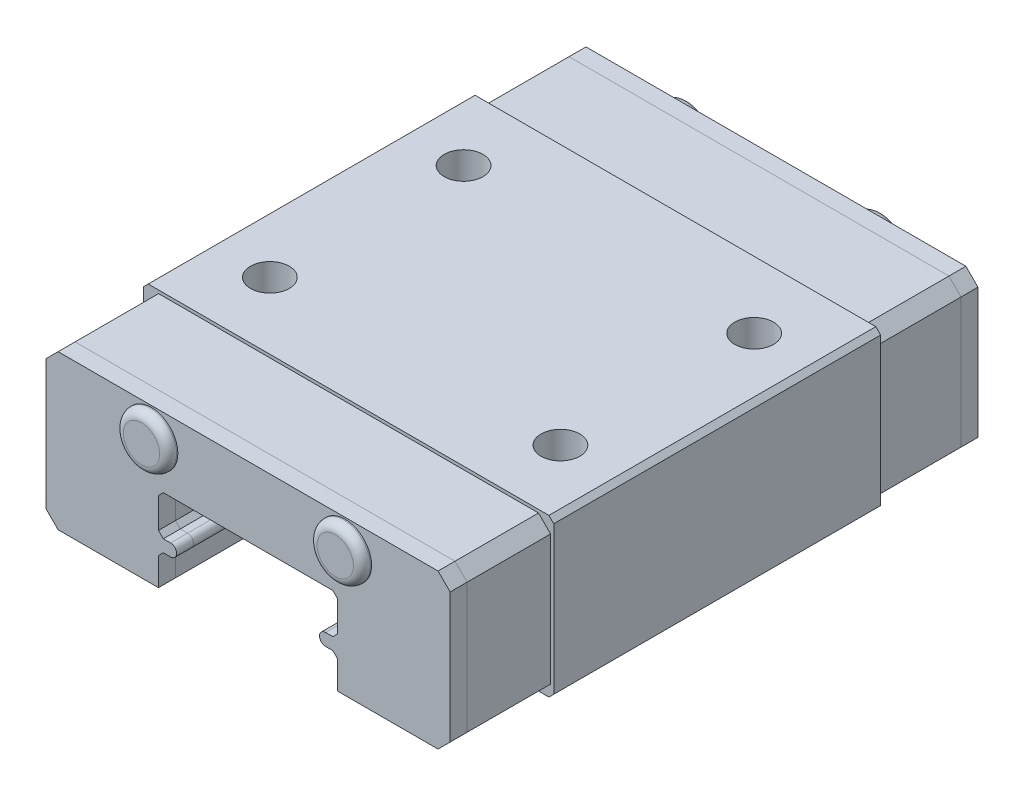
from build123d import *

# Parameters (mm, degrees)
SKETCH1_W                       = 16.95
SKETCH1_H                       = 6.5
BOSS_EXTRUDE1_DEPTH             = 6.75
CUT_EXTRUDE1_DEPTH              = 18.214111217
CUT_EXTRUDE1_DEPTH_BACK         = 18.214111217
CHAMFER1_SIZE                   = 0.2
TAP_DRILL_FOR_M2X0_4_TAP1_D     = 1.6
TAP_DRILL_FOR_M2X0_4_TAP1_DEPTH = 4.5
TAP_DRILL_FOR_M2X0_4_TAP1_TIP   = 0.480688495
BOSS_EXTRUDE2_DEPTH             = 3.45
CHAMFER2_SIZE                   = 0.5
BOSS_EXTRUDE3_DEPTH             = 0.7
SKETCH7_R                       = 1.1
BOSS_EXTRUDE4_DEPTH             = 0.4
BOSS_EXTRUDE4_2_DEPTH           = 0.4
FILLET1_R                       = 0.35
FILLET2_R                       = 0.35


with BuildPart() as part:
    # Sketch1 → Boss-Extrude1 (new, symmetric)
    with BuildSketch(Plane.XY):
        with Locations((0, 3.25)):
            Rectangle(SKETCH1_W, SKETCH1_H)
    extrude(amount=BOSS_EXTRUDE1_DEPTH, both=True)

    # Sketch2 → Cut-Extrude1 (cut, two sides: drawn at the far end of the back side and taken through both)
    with BuildSketch(Plane.XY.offset(6.75).offset(-CUT_EXTRUDE1_DEPTH_BACK)):
        with BuildLine():
            Line((-3.7, 0), (3.7, 0))
            Line((3.7, 0), (3.7, 1.35))
            Line((3.7, 1.35), (3.2, 1.35))
            ThreePointArc((3.2, 1.35), (2.95, 1.6), (3.2, 1.85))
            Line((3.2, 1.85), (3.7, 1.85))
            Line((3.7, 1.85), (3.7, 3.5))
            Line((3.7, 3.5), (-3.7, 3.5))
            Line((-3.7, 3.5), (-3.7, 1.85))
            Line((-3.7, 1.85), (-3.2, 1.85))
            ThreePointArc((-3.2, 1.85), (-2.95, 1.6), (-3.2, 1.35))
            Line((-3.2, 1.35), (-3.7, 1.35))
            Line((-3.7, 1.35), (-3.7, 0))
        make_face()
    extrude(amount=CUT_EXTRUDE1_DEPTH + CUT_EXTRUDE1_DEPTH_BACK, mode=Mode.SUBTRACT)

    # Chamfer1
    chamfer1_edges = [part.edges().sort_by_distance(p)[0] for p in [
        (3.7, 1.35, 0),
        (-3.7, 1.35, 0),
        (-3.7, 1.85, 0),
        (-3.7, 3.5, 0),
        (3.7, 3.5, 0),
        (3.7, 1.85, 0),
        (8.475, 0, 0),
        (-8.475, 0, 0),
        (-8.475, 6.5, 0),
        (8.475, 6.5, 0),
    ]]
    chamfer(chamfer1_edges, length=CHAMFER1_SIZE)

    # Tap Drill for M2x0.4 Tap1
    with Locations(Plane(origin=(0, 6.5, 0), x_dir=(1, 0, 0), z_dir=(0, 1, 0))):
        with Locations((-6, 4), (6, 4), (-6, -4), (6, -4)):
            Hole(TAP_DRILL_FOR_M2X0_4_TAP1_D / 2, depth=TAP_DRILL_FOR_M2X0_4_TAP1_DEPTH)
            with Locations((0, 0, -(TAP_DRILL_FOR_M2X0_4_TAP1_DEPTH + TAP_DRILL_FOR_M2X0_4_TAP1_TIP / 2))):  # 118° drill point
                Cone(0, TAP_DRILL_FOR_M2X0_4_TAP1_D / 2, TAP_DRILL_FOR_M2X0_4_TAP1_TIP, mode=Mode.SUBTRACT)


with BuildPart() as body_2:
    # Sketch5 → Boss-Extrude2 (new body)
    with BuildSketch(Plane.XY.offset(6.75)):
        with BuildLine():
            Line((-8.345, 0), (-3.7, 0))
            Line((-3.7, 0), (-3.7, 1.15))
            Line((-3.7, 1.15), (-3.5, 1.35))
            Line((-3.5, 1.35), (-3.2, 1.35))
            ThreePointArc((-3.2, 1.35), (-2.95, 1.6), (-3.2, 1.85))
            Line((-3.2, 1.85), (-3.5, 1.85))
            Line((-3.5, 1.85), (-3.7, 2.05))
            Line((-3.7, 2.05), (-3.7, 3.3))
            Line((-3.7, 3.3), (-3.5, 3.5))
            Line((-3.5, 3.5), (3.5, 3.5))
            Line((3.5, 3.5), (3.7, 3.3))
            Line((3.7, 3.3), (3.7, 2.05))
            Line((3.7, 2.05), (3.5, 1.85))
            Line((3.5, 1.85), (3.2, 1.85))
            ThreePointArc((3.2, 1.85), (2.95, 1.6), (3.2, 1.35))
            Line((3.2, 1.35), (3.5, 1.35))
            Line((3.5, 1.35), (3.7, 1.15))
            Line((3.7, 1.15), (3.7, 0))
            Line((3.7, 0), (8.345, 0))
            Line((8.345, 0), (8.345, 6.37))
            Line((8.345, 6.37), (-8.345, 6.37))
            Line((-8.345, 6.37), (-8.345, 0))
        make_face()
    extrude(amount=BOSS_EXTRUDE2_DEPTH)

    # Chamfer2
    chamfer2_edges = [body_2.edges().sort_by_distance(p)[0] for p in [
        (-8.345, 0, 8.475),
        (8.345, 0, 8.475),
        (8.345, 6.37, 8.475),
        (-8.345, 6.37, 8.475),
    ]]
    chamfer(chamfer2_edges, length=CHAMFER2_SIZE)


with BuildPart() as body_3:
    # Sketch6 → Boss-Extrude3 (new body)
    with BuildSketch(Plane.XY.offset(10.2)):
        with BuildLine():
            Line((-8.345, 5.87), (-8.345, 0.5))
            Line((-8.345, 0.5), (-7.845, 0))
            Line((-7.845, 0), (-3.7, 0))
            Line((-3.7, 0), (-3.7, 1.15))
            Line((-3.7, 1.15), (-3.5, 1.35))
            Line((-3.5, 1.35), (-3.2, 1.35))
            ThreePointArc((-3.2, 1.35), (-2.95, 1.6), (-3.2, 1.85))
            Line((-3.2, 1.85), (-3.5, 1.85))
            Line((-3.5, 1.85), (-3.7, 2.05))
            Line((-3.7, 2.05), (-3.7, 3.3))
            Line((-3.7, 3.3), (-3.5, 3.5))
            Line((-3.5, 3.5), (3.5, 3.5))
            Line((3.5, 3.5), (3.7, 3.3))
            Line((3.7, 3.3), (3.7, 2.05))
            Line((3.7, 2.05), (3.5, 1.85))
            Line((3.5, 1.85), (3.2, 1.85))
            ThreePointArc((3.2, 1.85), (2.95, 1.6), (3.2, 1.35))
            Line((3.2, 1.35), (3.5, 1.35))
            Line((3.5, 1.35), (3.7, 1.15))
            Line((3.7, 1.15), (3.7, 0))
            Line((3.7, 0), (7.845, 0))
            Line((7.845, 0), (8.345, 0.5))
            Line((8.345, 0.5), (8.345, 5.87))
            Line((8.345, 5.87), (7.845, 6.37))
            Line((7.845, 6.37), (-7.845, 6.37))
            Line((-7.845, 6.37), (-8.345, 5.87))
        make_face()
    extrude(amount=BOSS_EXTRUDE3_DEPTH)


with BuildPart() as body_4:
    # Sketch7 → Boss-Extrude4 (new body)
    with BuildSketch(Plane.XY.offset(10.9)):
        with Locations((-4, 5.2)):
            Circle(SKETCH7_R)
    extrude(amount=BOSS_EXTRUDE4_DEPTH)

    # Fillet1
    fillet1_edges = [body_4.edges().sort_by_distance(p)[0] for p in [
        (-5.1, 5.2, 11.3),
    ]]
    fillet(fillet1_edges, radius=FILLET1_R)


with BuildPart() as body_5:
    # Sketch7 → Boss-Extrude4 2 (new body)
    with BuildSketch(Plane.XY.offset(10.9)):
        with Locations((4, 5.2)):
            Circle(SKETCH7_R)
    extrude(amount=BOSS_EXTRUDE4_2_DEPTH)

    # Fillet2
    fillet2_edges = [body_5.edges().sort_by_distance(p)[0] for p in [
        (2.9, 5.2, 11.3),
    ]]
    fillet(fillet2_edges, radius=FILLET2_R)


with BuildPart() as body_6:
    # Mirror1: mirrored copy
    add(body_2.part.mirror(Plane.XY))


with BuildPart() as body_7:
    # Mirror1 2: mirrored copy
    add(body_3.part.mirror(Plane.XY))


with BuildPart() as body_8:
    # Mirror1 3: mirrored copy
    add(body_4.part.mirror(Plane.XY))


with BuildPart() as body_9:
    # Mirror1 4: mirrored copy
    add(body_5.part.mirror(Plane.XY))


solid = Compound([part.part, body_2.part, body_3.part, body_4.part, body_5.part, body_6.part, body_7.part, body_8.part, body_9.part])
